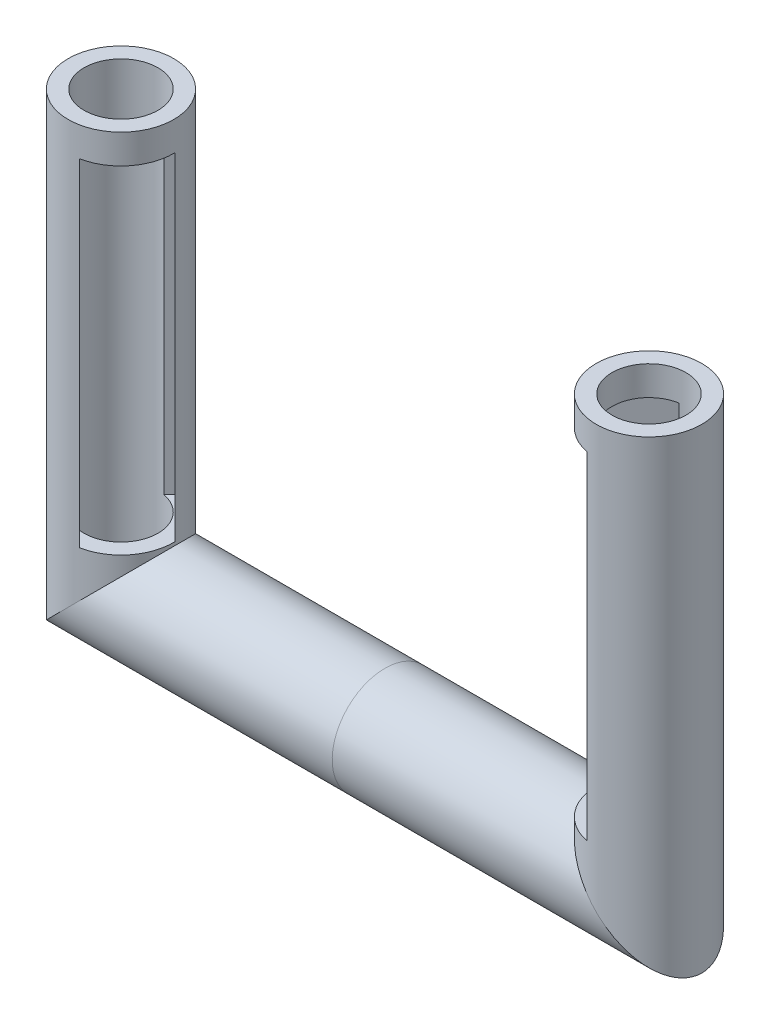
from build123d import *

# Parameters (mm, degrees)
SWEEP1_PROFILE_R                           = 5
SKETCH17_R                                 = 3.5
CUT_EXTRUDE1_DEPTH                         = 55.313902456
SKETCH18_W                                 = 31.905055519
SKETCH18_H                                 = 6.394424732
CUT_EXTRUDE2_DEPTH                         = 7
MIRROR1_AT_THE_SECOND_PLANE_COPY_1_SKETC_W = 31.905055519
MIRROR1_AT_THE_SECOND_PLANE_COPY_1_SKETC_H = 6.394424732
MIRROR1_AT_THE_SECOND_PLANE_COPY_1_DEPTH   = 7


with BuildPart() as part:
    # Sweep1: sweep along a path in Sketch1
    with BuildLine(Plane.XY) as sweep1_path:
        Line((-25, 0), (-25, -40))
        Line((-25, -40), (0, -40))
        Line((0, -40), (25, -40))
        Line((25, -40), (25, 0))
    # Sweep1 profile (on start of the path) → Sweep1 (sweep)
    with BuildSketch(Plane(origin=(-25, 0, 0), x_dir=(0, 0, -1), z_dir=(0, -1, 0))):
        Circle(SWEEP1_PROFILE_R)
    sweep(path=sweep1_path.line, transition=Transition.RIGHT)

    # Sketch17 → Cut-Extrude1 (cut, through all)
    with BuildSketch(Plane(origin=(0, 0, 0), x_dir=(1, 0, 0), z_dir=(0, 1, 0))):
        with Locations(Location((-25, 0, 0), (0, 0, 180))):
            Circle(SKETCH17_R)
        with Locations(Location((25, 0, 0), (0, 0, 180))):
            Circle(SKETCH17_R)
    extrude(amount=-CUT_EXTRUDE1_DEPTH, mode=Mode.SUBTRACT)

    # Sketch18 → Cut-Extrude2 (cut)
    with BuildSketch(Plane(origin=(-8.964466094, 0, -8.964466094), x_dir=(0, 1, 0), z_dir=(0.7071067811865488, 0, 0.7071067811865464))):
        with Locations((-18.731085844, 17.249970265)):
            Rectangle(SKETCH18_W, SKETCH18_H)
    cut_extrude2 = extrude(amount=-CUT_EXTRUDE2_DEPTH, mode=Mode.SUBTRACT)

    # Mirror1: Cut-Extrude2 across plane
    add(cut_extrude2.mirror(Plane(origin=(-8.964466094, 0, -8.964466094), x_dir=(-0.7071067811865465, 0, 0.7071067811865486), z_dir=(0.7071067811865488, 0, 0.7071067811865464))), mode=Mode.SUBTRACT)

    # Mirror1 at the second plane: Cut-Extrude2 across plane
    add(cut_extrude2.mirror(Plane(origin=(0, 0, 0), x_dir=(0, 0, 1), z_dir=(1, 0, 0))), mode=Mode.SUBTRACT)

    # Mirror1 at the second plane copy 1 sketc → Mirror1 at the second plane copy 1 (cut)
    with BuildSketch(Plane(origin=(8.964466094, 0, -8.964466094), x_dir=(0, 1, 0), z_dir=(0.707106781186549, 0, -0.7071067811865466))):
        with Locations((-18.731085844, 17.249970265)):
            Rectangle(MIRROR1_AT_THE_SECOND_PLANE_COPY_1_SKETC_W, MIRROR1_AT_THE_SECOND_PLANE_COPY_1_SKETC_H)
    extrude(amount=-MIRROR1_AT_THE_SECOND_PLANE_COPY_1_DEPTH, mode=Mode.SUBTRACT)


solid = part.part
